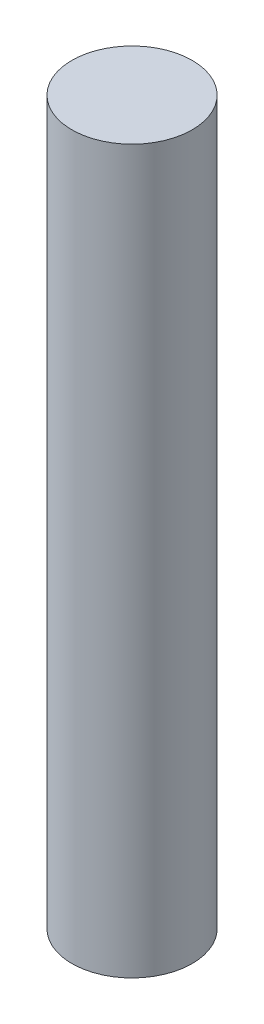
from build123d import *

# Parameters (mm, degrees)
CROQUIS1_W = 25
CROQUIS1_H = 300


with BuildPart() as part:
    # Croquis1 → Revolución1 (revolve)
    with BuildSketch(Plane.XY, mode=Mode.PRIVATE) as revoluci_n1_sk:
        with Locations((-12.5, 150)):
            Rectangle(CROQUIS1_W, CROQUIS1_H)
    revolve(revoluci_n1_sk.sketch.rotate(Axis((0, 0, 0), (0, 1, 0)), 270), axis=Axis((0, 0, 0), (0, 1, 0)))


solid = part.part
